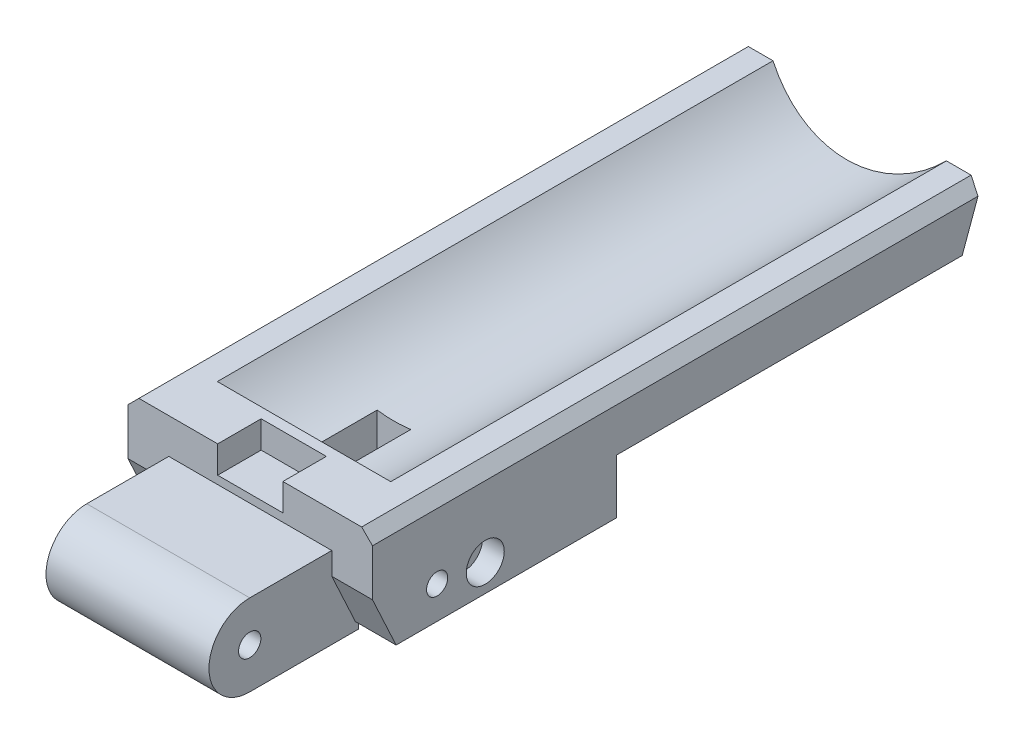
from build123d import *

# Parameters (mm, degrees)
SKETCH_1_R               = 7.5
SKETCH_1_R_2             = 2.05
EXTRUDE_1_DEPTH          = 15
EXTRUDE_2_DEPTH          = 22.5
SKETCH_3_R               = 22.6
CUT_EXTRUDE_1_DEPTH      = 125
SKETCH_5_W               = 80
SKETCH_5_H               = 15
CUT_EXTRUDE_2_DEPTH      = 15
CUT_EXTRUDE_3_DEPTH      = 131.008833765
CUT_EXTRUDE_3_DEPTH_BACK = 131.008833765
SKETCH_6_R               = 1.95
CUT_EXTRUDE_4_DEPTH      = 131.008833765
CUT_EXTRUDE_4_DEPTH_BACK = 131.008833765
SKETCH_10_R              = 1.95
CUT_EXTRUDE_5_DEPTH      = 131.008833765
CUT_EXTRUDE_5_DEPTH_BACK = 131.008833765
SKETCH_11_R              = 2.05
CUT_EXTRUDE_6_DEPTH      = 3.1
SKETCH_16_W              = 100
SKETCH_16_H              = 15.085035438
CUT_EXTRUDE_7_DEPTH      = 5
CHAMFER_1_SIZE           = 2
SKETCH_17_R              = 3.5
CUT_EXTRUDE_8_DEPTH      = 4
SKETCH_19_W              = 12
SKETCH_19_H              = 8
CUT_EXTRUDE_10_DEPTH     = 5
SKETCH_20_W              = 30
SKETCH_20_H              = 18.196576595
CUT_EXTRUDE_12_DEPTH     = 1.5
SKETCH_21_R              = 1.925
CUT_EXTRUDE_13_DEPTH     = 5


with BuildPart() as part:
    # 스케치1 → 보스-돌출1 (new, symmetric)
    # profile 1 of 2: a face of its own
    with BuildSketch(Plane(origin=(0, 0, 0), x_dir=(0, 0, -1), z_dir=(1, 0, 0))):
        with BuildLine():
            ThreePointArc((7.5, 0), (5.303300859, -5.303300859), (0, -7.5))
            Line((0, -7.5), (37.938480529, -7.5))
            Line((37.938480529, -7.5), (36.613399157, 7.5))
            Line((36.613399157, 7.5), (0, 7.5))
            ThreePointArc((0, 7.5), (5.303300859, 5.303300859), (7.5, 0))
        make_face()
    # profile 2 of 2: a face of its own
    with BuildSketch(Plane(origin=(0, 0, 0), x_dir=(0, 0, -1), z_dir=(1, 0, 0))):
        Circle(SKETCH_1_R)
        Circle(SKETCH_1_R_2, mode=Mode.SUBTRACT)
    extrude(amount=EXTRUDE_1_DEPTH, both=True)

    # 스케치2 → 보스-돌출2 (add, symmetric)
    with BuildSketch(Plane(origin=(0, 0, 0), x_dir=(0, 0, -1), z_dir=(1, 0, 0))):
        Polygon((15.1, 3.389248282), (15.1, 14), (127.279404685, 14), (120, -6), (19.447603562, -6), align=None)
    extrude(amount=EXTRUDE_2_DEPTH, both=True)

    # 스케치3 → 컷-돌출1 (cut)
    with BuildSketch(Plane.XY.offset(-150)):
        with Locations((0, 30)):
            Circle(SKETCH_3_R)
    extrude(amount=CUT_EXTRUDE_1_DEPTH, mode=Mode.SUBTRACT)

    # 스케치5 → 컷-돌출2 (cut)
    with BuildSketch(Plane(origin=(22.5, 0, 0), x_dir=(0, 0, -1), z_dir=(1, 0, 0))):
        with Locations((100, -3.5)):
            Rectangle(SKETCH_5_W, SKETCH_5_H)
    cut_extrude_2 = extrude(amount=-CUT_EXTRUDE_2_DEPTH, mode=Mode.SUBTRACT)

    # 대칭 복사1: 컷-돌출2 across plane
    add(cut_extrude_2.mirror(Plane(origin=(0, 0, 0), x_dir=(0, 0, 1), z_dir=(1, 0, 0))), mode=Mode.SUBTRACT)

    # 스케치6 → 컷-돌출3 (cut, two sides: drawn at the far end of the back side and taken through both)
    with BuildSketch(Plane(origin=(0, 0, 0), x_dir=(0, 0, -1), z_dir=(1, 0, 0)).offset(-CUT_EXTRUDE_3_DEPTH_BACK)):
        with Locations((70, -1)):
            Circle(SKETCH_6_R)
        with Locations((110, -1)):
            Circle(SKETCH_6_R)
    extrude(amount=CUT_EXTRUDE_3_DEPTH + CUT_EXTRUDE_3_DEPTH_BACK, mode=Mode.SUBTRACT)

    # 스케치10 → 컷-돌출4 (cut, two sides: drawn at the far end of the back side and taken through both)
    with BuildSketch(Plane(origin=(0, 0, 0), x_dir=(0, 0, -1), z_dir=(1, 0, 0)).offset(-CUT_EXTRUDE_4_DEPTH_BACK)):
        with Locations((27, 0)):
            Circle(SKETCH_10_R)
    extrude(amount=CUT_EXTRUDE_4_DEPTH + CUT_EXTRUDE_4_DEPTH_BACK, mode=Mode.SUBTRACT)

    # 스케치11 → 컷-돌출5 (cut, two sides: drawn at the far end of the back side and taken through both)
    with BuildSketch(Plane(origin=(0, 0, 0), x_dir=(0, 0, -1), z_dir=(1, 0, 0)).offset(-CUT_EXTRUDE_5_DEPTH_BACK)):
        with Locations((35.850364983, -1)):
            Circle(SKETCH_11_R)
    extrude(amount=CUT_EXTRUDE_5_DEPTH + CUT_EXTRUDE_5_DEPTH_BACK, mode=Mode.SUBTRACT)

    # 스케치12 → 컷-돌출6 (cut, symmetric)
    with BuildSketch(Plane(origin=(0, 0, 0), x_dir=(0, 0, -1), z_dir=(1, 0, 0))):
        with BuildLine():
            Line((30.150364983, -1), (30.150364983, 12.943670284))
            ThreePointArc((30.150364983, 12.943670284), (35.850364983, 18.643670284), (41.550364983, 12.943670284))
            Line((41.550364983, 12.943670284), (41.550364983, -1))
            ThreePointArc((41.550364983, -1), (35.850364983, -6.7), (30.150364983, -1))
        make_face()
    extrude(amount=CUT_EXTRUDE_6_DEPTH, both=True, mode=Mode.SUBTRACT)

    # 스케치16 → 컷-돌출7 (cut, symmetric)
    with BuildSketch(Plane(origin=(0, 0, 0), x_dir=(0, 0, -1), z_dir=(1, 0, 0))):
        with Locations((70, -12.542517719)):
            Rectangle(SKETCH_16_W, SKETCH_16_H)
    extrude(amount=CUT_EXTRUDE_7_DEPTH, both=True, mode=Mode.SUBTRACT)

    # 모따기1
    chamfer_1_edges = [part.edges().sort_by_distance(p)[0] for p in [
        (-22.5, 14, -71.189702343),
        (22.5, 14, -71.189702343),
    ]]
    chamfer(chamfer_1_edges, length=CHAMFER_1_SIZE)

    # 스케치17 → 컷-돌출8 (cut)
    with BuildSketch(Plane(origin=(22.5, 0, 0), x_dir=(0, 0, -1), z_dir=(1, 0, 0))):
        with Locations((35.850364983, -1)):
            Circle(SKETCH_17_R)
    extrude(amount=-CUT_EXTRUDE_8_DEPTH, mode=Mode.SUBTRACT)

    # 스케치19 → 컷-돌출10 (cut)
    with BuildSketch(Plane(origin=(0, 14, 0), x_dir=(1, 0, 0), z_dir=(0, 1, 0))):
        with Locations((0, 19.1)):
            Rectangle(SKETCH_19_W, SKETCH_19_H)
    extrude(amount=-CUT_EXTRUDE_10_DEPTH, mode=Mode.SUBTRACT)

    # 스케치20 → 컷-돌출12 (cut)
    with BuildSketch(Plane.XZ.offset(6)):
        with Locations((0, -29.098288298)):
            Rectangle(SKETCH_20_W, SKETCH_20_H)
    extrude(amount=CUT_EXTRUDE_12_DEPTH, mode=Mode.SUBTRACT)

    # 스케치21 → 컷-돌출13 (cut)
    with BuildSketch(Plane.XZ.offset(6)):
        with Locations(Location((12, -42, 0), (0, 0, 270))):
            Circle(SKETCH_21_R)
        with Locations(Location((-12, -42, 0), (0, 0, 90))):
            Circle(SKETCH_21_R)
    extrude(amount=-CUT_EXTRUDE_13_DEPTH, mode=Mode.SUBTRACT)


solid = part.part
